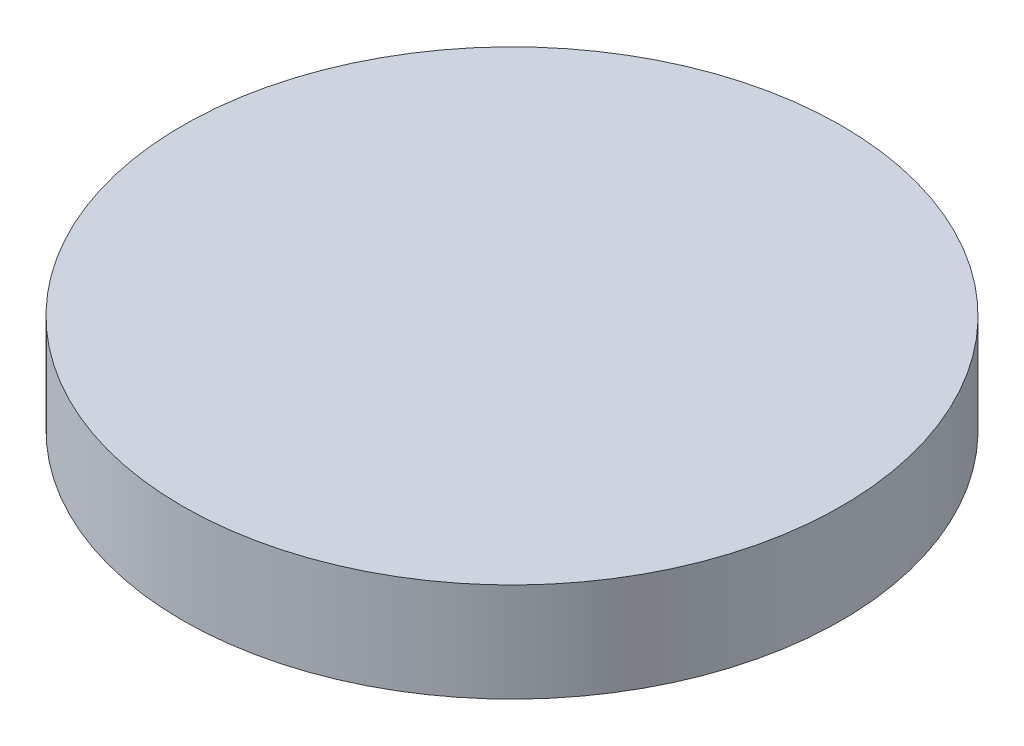
from build123d import *

# Parameters (mm, degrees)
SKETCH1_R           = 25.4
BOSS_EXTRUDE2_DEPTH = 7.62
SKETCH4_R           = 4.826
CUT_EXTRUDE2_DEPTH  = 3.048
CIRPATTERN1_COUNT   = 6
SKETCH5_R           = 4.826
CUT_EXTRUDE6_DEPTH  = 3.048
SKETCH7_R           = 1.5875
CUT_EXTRUDE7_DEPTH  = 1.5875


with BuildPart() as part:
    # Sketch1 → Boss-Extrude2 (new body)
    with BuildSketch(Plane(origin=(0, 0, 0), x_dir=(1, 0, 0), z_dir=(0, 1, 0))):
        with Locations(Location((0, 0, 0), (0, 0, 270))):
            Circle(SKETCH1_R)
    extrude(amount=BOSS_EXTRUDE2_DEPTH)

    # Sketch4 → Cut-Extrude2 (cut)
    with BuildSketch(Plane(origin=(0, 0, 0), x_dir=(1, 0, 0), z_dir=(0, 1, 0))):
        with Locations(Location((0, 17.78, 0), (0, 0, 90))):
            Circle(SKETCH4_R)
    cut_extrude2 = extrude(amount=CUT_EXTRUDE2_DEPTH, mode=Mode.SUBTRACT)

    # CirPattern1: Cut-Extrude2 ×6 about axis
    cirpattern1_axis = Axis((0, 0, 0), (0, 1, 0))
    for i in range(1, CIRPATTERN1_COUNT):
        add(cut_extrude2.rotate(cirpattern1_axis, i * 360 / CIRPATTERN1_COUNT), mode=Mode.SUBTRACT)

    # Sketch5 → Cut-Extrude6 (cut)
    with BuildSketch(Plane(origin=(0, 0, 0), x_dir=(1, 0, 0), z_dir=(0, 1, 0))):
        with Locations(Location((0, 0, 0), (0, 0, 90))):
            Circle(SKETCH5_R)
    extrude(amount=CUT_EXTRUDE6_DEPTH, mode=Mode.SUBTRACT)

    # Sketch7 → Cut-Extrude7 (cut)
    with BuildSketch(Plane.XZ):
        with Locations(Location((4.532486744, 7.647788172, 0), (0, 0, 270))):
            Circle(SKETCH7_R)
        with Locations(Location((4.356935467, -7.749142748, 0), (0, 0, 270))):
            Circle(SKETCH7_R)
        with Locations(Location((-8.889422211, 0.101354577, 0), (0, 0, 270))):
            Circle(SKETCH7_R)
    extrude(amount=-CUT_EXTRUDE7_DEPTH, mode=Mode.SUBTRACT)


solid = part.part
